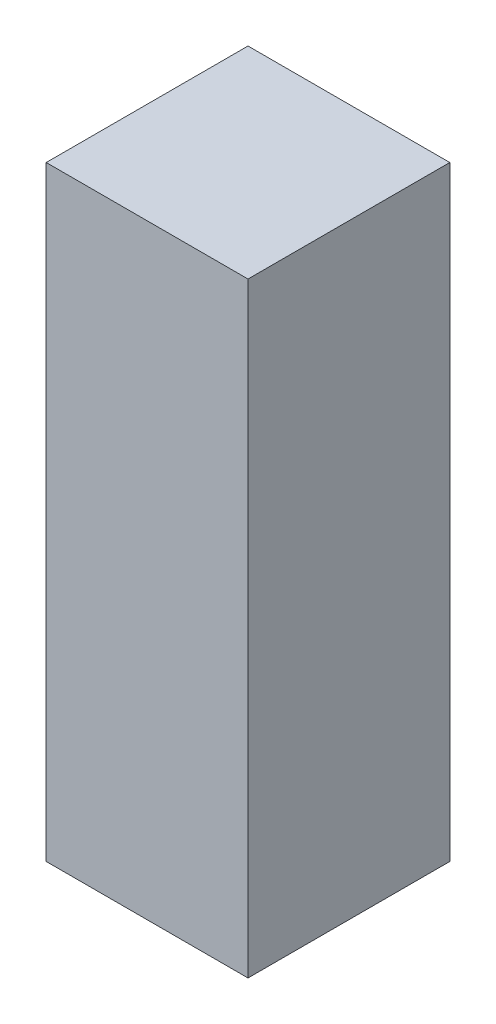
from build123d import *

# Parameters (mm, degrees)
SKETCH1_W           = 75
SKETCH1_H           = 75
BOSS_EXTRUDE1_DEPTH = 225


with BuildPart() as part:
    # Sketch1 → Boss-Extrude1 (new body)
    with BuildSketch(Plane(origin=(0, 0, 0), x_dir=(1, 0, 0), z_dir=(0, 1, 0))):
        Rectangle(SKETCH1_W, SKETCH1_H)
    extrude(amount=BOSS_EXTRUDE1_DEPTH)


solid = part.part
